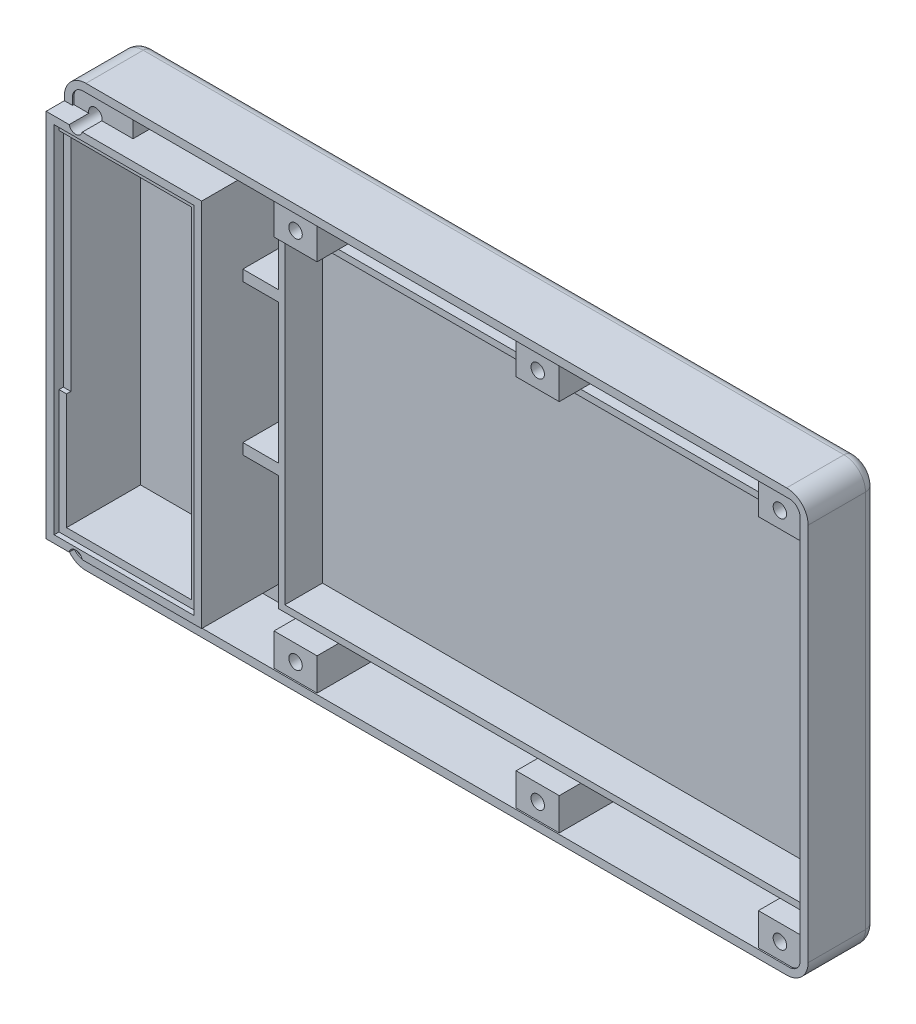
from build123d import *

# Parameters (mm, degrees)
ESQUISSE1_W             = 138.2
ESQUISSE1_H             = 78.4
BOSS_EXTRU_1_DEPTH      = 12.65
BOSS_EXTRU_2_DEPTH      = 1.4
BOSS_EXTRU_5_START      = 1.4
ESQUISSE1_5_R           = 1.25
BOSS_EXTRU_5_DEPTH      = 11
ESQUISSE1_5_W           = 8
ESQUISSE1_5_H           = 6
BOSS_EXTRU_5_2_DEPTH    = 11
BOSS_EXTRU_5_3_DEPTH    = 11
BOSS_EXTRU_5_4_DEPTH    = 11
BOSS_EXTRU_5_5_DEPTH    = 11
BOSS_EXTRU_5_6_DEPTH    = 11
BOSS_EXTRU_7_START      = 1.4
BOSS_EXTRU_7_DEPTH      = 7
CONG_1_R                = 4
CONG_4_R                = 2
BOSS_EXTRU_8_START      = 1.4
BOSS_EXTRU_8_DEPTH      = 13.75
BOSS_EXTRU_9_START      = 1.4
BOSS_EXTRU_9_DEPTH      = 14.65
BOSS_EXTRU_11_START     = 11
ESQUISSE4_R             = 1.25
BOSS_EXTRU_11_DEPTH     = 11
ESQUISSE5_W             = 6.6
ESQUISSE5_H             = 2
BOSS_EXTRU_12_DEPTH     = 7
CONG_3_R                = 2
ESQUISSE7_W             = 1.4
ESQUISSE7_H             = 41.680372202
ENL_V_MAT_EXTRU_3_DEPTH = 0.8
ESQUISSE2_W             = 1.5
ESQUISSE2_H             = 68.8
BOSS_EXTRU_14_DEPTH     = 3.4
ENL_V_START             = 30.15
ENL_V_MAT_EXTRU_4_DEPTH = 30.15


with BuildPart() as part:
    # Esquisse1 → Boss.-Extru.1 (new body)
    with BuildSketch(Plane.XY):
        with Locations((67.6, 37.7)):
            Rectangle(ESQUISSE1_W, ESQUISSE1_H)
        with BuildLine():
            Line((0, 0), (133.2, 0))
            ThreePointArc((133.2, 0), (134.614213562, 0.585786438), (135.2, 2))
            Line((135.2, 2), (135.2, 73.4))
            ThreePointArc((135.2, 73.4), (134.614213562, 74.814213562), (133.2, 75.4))
            Line((133.2, 75.4), (0, 75.4))
            Line((0, 75.4), (0, 0))
        make_face(mode=Mode.SUBTRACT)
    extrude(amount=BOSS_EXTRU_1_DEPTH)

    # Esquisse1<4> → Boss.-Extru.2 (add)
    with BuildSketch(Plane.XY):
        with BuildLine():
            Line((0, 0), (133.2, 0))
            ThreePointArc((133.2, 0), (134.614213562, 0.585786438), (135.2, 2))
            Line((135.2, 2), (135.2, 73.4))
            ThreePointArc((135.2, 73.4), (134.614213562, 74.814213562), (133.2, 75.4))
            Line((133.2, 75.4), (0, 75.4))
            Line((0, 75.4), (0, 0))
        make_face()
    extrude(amount=BOSS_EXTRU_2_DEPTH)

    # Esquisse1<6> → Boss.-Extru.7 (add)
    with BuildSketch(Plane.XY.offset(BOSS_EXTRU_7_START)):
        Polygon((135.2, 68.2), (135.2, 69.4), (127.2, 69.4), (90.2, 69.4), (82.2, 69.4), (45.2, 69.4), (37.2, 69.4), (34, 69.4), (34, 37.7), (35.2, 37.7), (35.2, 68.2), align=None)
        Polygon((135.2, 6), (135.2, 7.2), (35.2, 7.2), (35.2, 37.7), (34, 37.7), (34, 6), (37.2, 6), (45.2, 6), (82.2, 6), (90.2, 6), (127.2, 6), align=None)
    extrude(amount=BOSS_EXTRU_7_DEPTH)

    # Congé1
    cong_1_edges = [part.edges().sort_by_distance(p)[0] for p in [
        (-1.5, 76.9, 6.325),
        (136.7, 76.9, 6.325),
        (136.7, -1.5, 6.325),
        (-1.5, -1.5, 6.325),
    ]]
    fillet(cong_1_edges, radius=CONG_1_R)

    # Congé4
    cong_4_edges = [part.edges().sort_by_distance(p)[0] for p in [
        (0, 75.4, 7.025),
        (0, 0, 7.025),
    ]]
    fillet(cong_4_edges, radius=CONG_4_R)

    # Esquisse1<7> → Boss.-Extru.8 (add)
    with BuildSketch(Plane.XY.offset(BOSS_EXTRU_8_START)):
        Polygon((24.6, 37.7), (26, 37.7), (26, 70.7), (0, 70.7), (0, 37.7), (1.4, 37.7), (1.4, 69.3), (24.6, 69.3), align=None)
        Polygon((26, 4.7), (26, 37.7), (24.6, 37.7), (24.6, 6.1), (1.4, 6.1), (1.4, 37.7), (0, 37.7), (0, 4.7), align=None)
    extrude(amount=BOSS_EXTRU_8_DEPTH)

    # Esquisse1<8> → Boss.-Extru.9 (add)
    with BuildSketch(Plane.XY.offset(BOSS_EXTRU_9_START)):
        Polygon((27.4, 3.3), (27.4, 72.1), (0, 72.1), (0, 70.7), (26, 70.7), (26, 4.7), (0, 4.7), (0, 3.3), align=None)
    extrude(amount=BOSS_EXTRU_9_DEPTH)

    # Esquisse4 → Boss.-Extru.11 (add)
    # profile 1 of 2: a face of its own
    with BuildSketch(Plane.XY.offset(1.4).offset(BOSS_EXTRU_11_START)):
        with BuildLine():
            Line((11, 75.4), (2, 75.4))
            ThreePointArc((2, 75.4), (0.585786438, 74.814213562), (0, 73.4))
            Line((0, 73.4), (0, 70.737356087))
            Line((0, 70.737356087), (11, 70.737356087))
            Line((11, 70.737356087), (11, 75.4))
        make_face()
        with Locations((4, 72.4)):
            Circle(ESQUISSE4_R, mode=Mode.SUBTRACT)
    # profile 2 of 2: a face of its own
    with BuildSketch(Plane.XY.offset(1.4).offset(BOSS_EXTRU_11_START)):
        with BuildLine():
            Line((0, 4.608067271), (11, 4.608067271))
            Line((11, 4.608067271), (11, 0))
            Line((11, 0), (2, 0))
            ThreePointArc((2, 0), (0.585786438, 0.585786438), (0, 2))
            Line((0, 2), (0, 4.608067271))
        make_face()
        with Locations((4, 3)):
            Circle(ESQUISSE4_R, mode=Mode.SUBTRACT)
    extrude(amount=-BOSS_EXTRU_11_DEPTH)

    # Esquisse5 → Boss.-Extru.12 (add)
    with BuildSketch(Plane.XY.offset(1.4)):
        with Locations((30.7, 56.329620473)):
            Rectangle(ESQUISSE5_W, ESQUISSE5_H)
        with Locations((30.7, 28.421993419)):
            Rectangle(ESQUISSE5_W, ESQUISSE5_H)
    extrude(amount=BOSS_EXTRU_12_DEPTH)

    # Congé3
    cong_3_edges = [part.edges().sort_by_distance(p)[0] for p in [
        (-1.5, 37.7, 0),
        (67.6, 76.9, 0),
        (136.7, 37.7, 0),
        (67.6, -1.5, 0),
        (135.528427125, 75.728427125, 0),
        (135.528427125, -0.328427125, 0),
        (-0.328427125, -0.328427125, 0),
        (-0.328427125, 75.728427125, 0),
    ]]
    fillet(cong_3_edges, radius=CONG_3_R)

    # Esquisse7 → Enlèv. mat.-Extru.3 (cut)
    with BuildSketch(Plane.XY.offset(15.15)):
        with Locations((0.7, 48.459813899)):
            Rectangle(ESQUISSE7_W, ESQUISSE7_H)
    extrude(amount=-ENL_V_MAT_EXTRU_3_DEPTH, mode=Mode.SUBTRACT)

    # Esquisse2 → Boss.-Extru.14 (add)
    with BuildSketch(Plane.XY.offset(12.65)):
        with Locations((-0.75, 37.7)):
            Rectangle(ESQUISSE2_W, ESQUISSE2_H)
    extrude(amount=BOSS_EXTRU_14_DEPTH)

    # Esquisse4<2> → Enlèv. mat.-Extru.4 (cut)
    with BuildSketch(Plane.XY.offset(1.4).offset(ENL_V_START)):
        with BuildLine():
            Line((2.78653389, 72.1), (5.21346611, 72.1))
            ThreePointArc((5.21346611, 72.1), (5.240832913, 72.248891823), (5.25, 72.4))
            ThreePointArc((5.25, 72.4), (3.848891823, 73.640832913), (2.78653389, 72.1))
        make_face()
        with BuildLine():
            ThreePointArc((2.78653389, 72.1), (4, 71.15), (5.21346611, 72.1))
            Line((5.21346611, 72.1), (2.78653389, 72.1))
        make_face()
        with BuildLine():
            Line((5.21346611, 3.3), (2.78653389, 3.3))
            ThreePointArc((2.78653389, 3.3), (3.848891823, 1.759167087), (5.25, 3))
            ThreePointArc((5.25, 3), (5.240832913, 3.151108177), (5.21346611, 3.3))
        make_face()
        with BuildLine():
            ThreePointArc((5.21346611, 3.3), (4, 4.25), (2.78653389, 3.3))
            Line((2.78653389, 3.3), (5.21346611, 3.3))
        make_face()
    extrude(amount=-ENL_V_MAT_EXTRU_4_DEPTH, mode=Mode.SUBTRACT)


with BuildPart() as body_2:
    # Esquisse1<5> → Boss.-Extru.5 (new body)
    with BuildSketch(Plane.XY.offset(BOSS_EXTRU_5_START)):
        with BuildLine():
            Line((127.2, 69.4), (135.2, 69.4))
            Line((135.2, 69.4), (135.2, 73.4))
            ThreePointArc((135.2, 73.4), (134.614213562, 74.814213562), (133.2, 75.4))
            Line((133.2, 75.4), (127.2, 75.4))
            Line((127.2, 75.4), (127.2, 69.4))
        make_face()
        with Locations(Location((131.2, 72.4, 0), (0, 0, 180))):
            Circle(ESQUISSE1_5_R, mode=Mode.SUBTRACT)
    extrude(amount=BOSS_EXTRU_5_DEPTH)


with BuildPart() as body_3:
    # Esquisse1<5> → Boss.-Extru.5 2 (new body)
    with BuildSketch(Plane.XY.offset(BOSS_EXTRU_5_START)):
        with Locations((86.2, 72.4)):
            Rectangle(ESQUISSE1_5_W, ESQUISSE1_5_H)
        with Locations(Location((86.2, 72.4, 0), (0, 0, 180))):
            Circle(ESQUISSE1_5_R, mode=Mode.SUBTRACT)
    extrude(amount=BOSS_EXTRU_5_2_DEPTH)


with BuildPart() as body_4:
    # Esquisse1<5> → Boss.-Extru.5 3 (new body)
    with BuildSketch(Plane.XY.offset(BOSS_EXTRU_5_START)):
        with BuildLine():
            Line((135.2, 2), (135.2, 6))
            Line((135.2, 6), (127.2, 6))
            Line((127.2, 6), (127.2, 0))
            Line((127.2, 0), (133.2, 0))
            ThreePointArc((133.2, 0), (134.614213562, 0.585786438), (135.2, 2))
        make_face()
        with Locations(Location((131.2, 3, 0), (0, 0, 180))):
            Circle(ESQUISSE1_5_R, mode=Mode.SUBTRACT)
    extrude(amount=BOSS_EXTRU_5_3_DEPTH)


with BuildPart() as body_5:
    # Esquisse1<5> → Boss.-Extru.5 4 (new body)
    with BuildSketch(Plane.XY.offset(BOSS_EXTRU_5_START)):
        with Locations((41.2, 72.4)):
            Rectangle(ESQUISSE1_5_W, ESQUISSE1_5_H)
        with Locations(Location((41.2, 72.4, 0), (0, 0, 180))):
            Circle(ESQUISSE1_5_R, mode=Mode.SUBTRACT)
    extrude(amount=BOSS_EXTRU_5_4_DEPTH)


with BuildPart() as body_6:
    # Esquisse1<5> → Boss.-Extru.5 5 (new body)
    with BuildSketch(Plane.XY.offset(BOSS_EXTRU_5_START)):
        with Locations((86.2, 3)):
            Rectangle(ESQUISSE1_5_W, ESQUISSE1_5_H)
        with Locations(Location((86.2, 3, 0), (0, 0, 180))):
            Circle(ESQUISSE1_5_R, mode=Mode.SUBTRACT)
    extrude(amount=BOSS_EXTRU_5_5_DEPTH)


with BuildPart() as body_7:
    # Esquisse1<5> → Boss.-Extru.5 6 (new body)
    with BuildSketch(Plane.XY.offset(BOSS_EXTRU_5_START)):
        with Locations((41.2, 3)):
            Rectangle(ESQUISSE1_5_W, ESQUISSE1_5_H)
        with Locations(Location((41.2, 3, 0), (0, 0, 180))):
            Circle(ESQUISSE1_5_R, mode=Mode.SUBTRACT)
    extrude(amount=BOSS_EXTRU_5_6_DEPTH)


solid = Compound([part.part, body_2.part, body_3.part, body_4.part, body_5.part, body_6.part, body_7.part])
